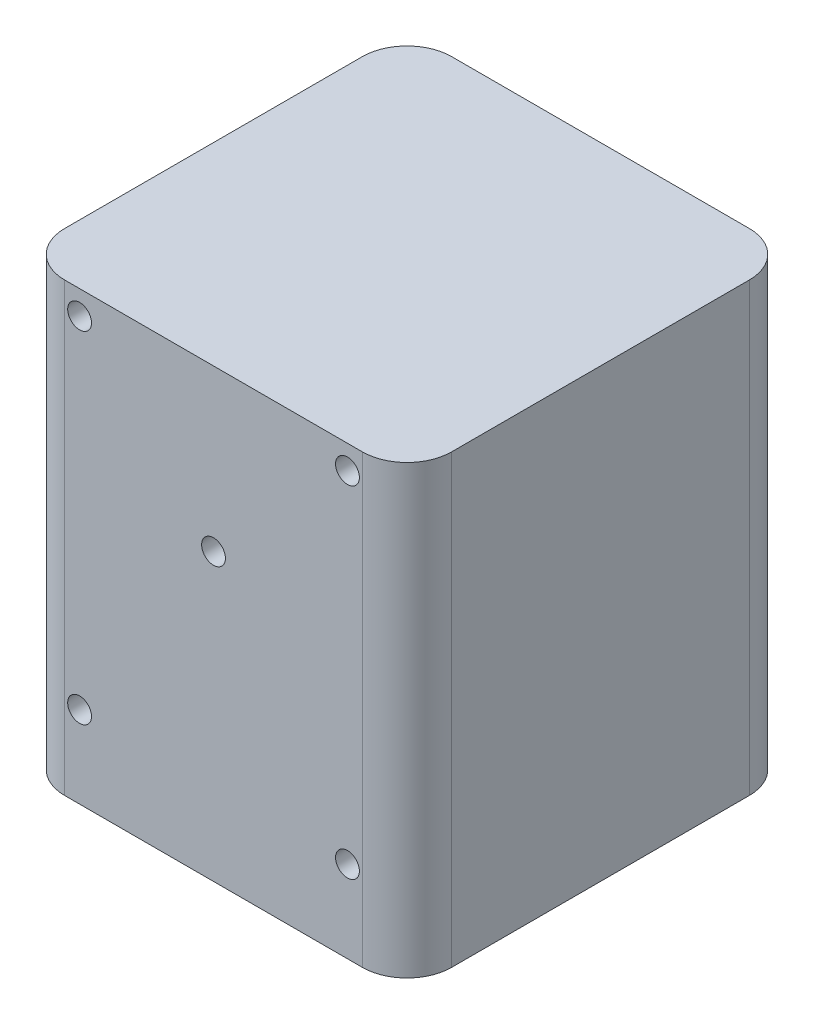
from build123d import *

# Parameters (mm, degrees)
SKETCH1_W                  = 26
SKETCH1_H                  = 26
BOSS_EXTRUDE1_DEPTH        = 15
FILLET1_R                  = 3
SKETCH2_R                  = 12
CUT_EXTRUDE1_DEPTH         = 10
M2_TAPPED_HOLE2_AT_2_COUNT = 2
M2_TAPPED_HOLE2_AT_2_PITCH = 18
M2_TAPPED_HOLE2_AT_3_COUNT = 2
M2_TAPPED_HOLE2_AT_3_PITCH = 12.870120435
M2_TAPPED_HOLE2_AT_4_COUNT = 2
M2_TAPPED_HOLE2_AT_4_PITCH = 22.9
M2_TAPPED_HOLE2_AT_5_COUNT = 2
M2_TAPPED_HOLE2_AT_5_PITCH = 29.127478435


with BuildPart() as part:
    # Sketch1 → Boss-Extrude1 (new, symmetric)
    with BuildSketch(Plane(origin=(0, 0, 0), x_dir=(1, 0, 0), z_dir=(0, 1, 0))):
        Rectangle(SKETCH1_W, SKETCH1_H)
    extrude(amount=BOSS_EXTRUDE1_DEPTH, both=True)

    # Fillet1
    fillet1_edges = [part.edges().sort_by_distance(p)[0] for p in [
        (13, 0, 13),
        (-13, 0, 13),
        (-13, 0, -13),
        (13, 0, -13),
    ]]
    fillet(fillet1_edges, radius=FILLET1_R)

    # Sketch2 → Cut-Extrude1 (cut)
    with BuildSketch(Plane.XZ.offset(15)):
        with Locations(Location((0, 0, 0), (0, 0, 270))):
            Circle(SKETCH2_R)
    extrude(amount=-CUT_EXTRUDE1_DEPTH, mode=Mode.SUBTRACT)

    # Sketch4 → M2 Tapped Hole2 (revolve, cut)
    with BuildSketch(Plane(origin=(-9, 13.4, 13), x_dir=(0, -1, 0), z_dir=(1, 0, 0))):
        Polygon((0, 0), (0, 2.980688495), (0.8, 2.5), (0.8, 0), align=None)
    m2_tapped_hole2 = revolve(axis=Axis((-9, 13.4, 19.35), (0, 0, -1)), mode=Mode.SUBTRACT)

    # M2 Tapped Hole2 at 2: M2 Tapped Hole2 ×2
    with Locations(*[(i * M2_TAPPED_HOLE2_AT_2_PITCH, 0, 0) for i in range(1, M2_TAPPED_HOLE2_AT_2_COUNT)]):
        add(m2_tapped_hole2, mode=Mode.SUBTRACT)

    # M2 Tapped Hole2 at 3: M2 Tapped Hole2 ×2
    with Locations(*[Vector(0.6992941554637311, -0.7148340255851474, 0) * (i * M2_TAPPED_HOLE2_AT_3_PITCH) for i in range(1, M2_TAPPED_HOLE2_AT_3_COUNT)]):
        add(m2_tapped_hole2, mode=Mode.SUBTRACT)

    # M2 Tapped Hole2 at 4: M2 Tapped Hole2 ×2
    with Locations(*[(0, -i * M2_TAPPED_HOLE2_AT_4_PITCH, 0) for i in range(1, M2_TAPPED_HOLE2_AT_4_COUNT)]):
        add(m2_tapped_hole2, mode=Mode.SUBTRACT)

    # M2 Tapped Hole2 at 5: M2 Tapped Hole2 ×2
    with Locations(*[Vector(0.6179731637247914, -0.7861991916276512, 0) * (i * M2_TAPPED_HOLE2_AT_5_PITCH) for i in range(1, M2_TAPPED_HOLE2_AT_5_COUNT)]):
        add(m2_tapped_hole2, mode=Mode.SUBTRACT)

    # Mirror1: M2 Tapped Hole2 across plane
    add(m2_tapped_hole2.mirror(Plane.XY), mode=Mode.SUBTRACT)

    # Mirror1 copy 1 sketch → Mirror1 copy 1 (revolve, cut)
    with BuildSketch(Plane(origin=(9, 13.4, -13), x_dir=(0, -1, 0), z_dir=(1, 0, 0))):
        Polygon((0, 0), (0, -2.980688495), (0.8, -2.5), (0.8, 0), align=None)
    revolve(axis=Axis((9, 13.4, -19.35), (0, 0, -1)), mode=Mode.SUBTRACT)

    # Mirror1 copy 2 sketch → Mirror1 copy 2 (revolve, cut)
    with BuildSketch(Plane(origin=(0, 4.2, -13), x_dir=(0, -1, 0), z_dir=(1, 0, 0))):
        Polygon((0, 0), (0, -2.980688495), (0.8, -2.5), (0.8, 0), align=None)
    revolve(axis=Axis((0, 4.2, -19.35), (0, 0, -1)), mode=Mode.SUBTRACT)

    # Mirror1 copy 3 sketch → Mirror1 copy 3 (revolve, cut)
    with BuildSketch(Plane(origin=(-9, -9.5, -13), x_dir=(0, -1, 0), z_dir=(1, 0, 0))):
        Polygon((0, 0), (0, -2.980688495), (0.8, -2.5), (0.8, 0), align=None)
    revolve(axis=Axis((-9, -9.5, -19.35), (0, 0, -1)), mode=Mode.SUBTRACT)

    # Mirror1 copy 4 sketch → Mirror1 copy 4 (revolve, cut)
    with BuildSketch(Plane(origin=(9, -9.5, -13), x_dir=(0, -1, 0), z_dir=(1, 0, 0))):
        Polygon((0, 0), (0, -2.980688495), (0.8, -2.5), (0.8, 0), align=None)
    revolve(axis=Axis((9, -9.5, -19.35), (0, 0, -1)), mode=Mode.SUBTRACT)


solid = part.part
